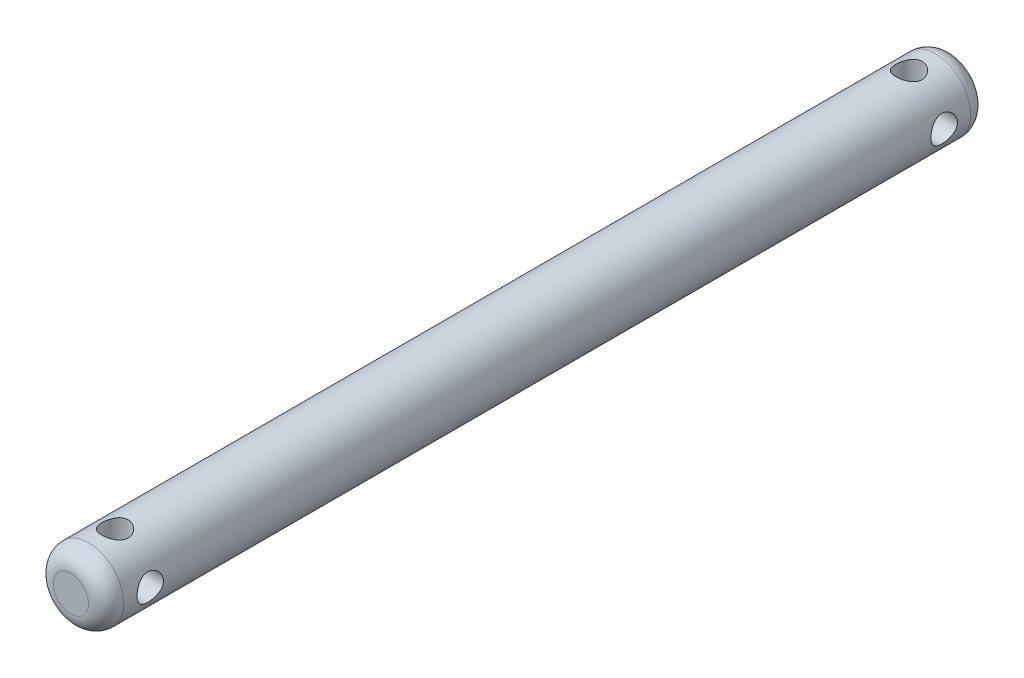
from build123d import *

# Parameters (mm, degrees)
SKETCH1_R           = 4
BOSS_EXTRUDE1_DEPTH = 50
SKETCH2_R           = 1.5
CUT_EXTRUDE1_DEPTH  = 5
FILLET1_R           = 2
SKETCH3_R           = 1.5
CUT_EXTRUDE2_DEPTH  = 4


with BuildPart() as part:
    # Sketch1 → Boss-Extrude1 (new, symmetric)
    with BuildSketch(Plane.XY):
        Circle(SKETCH1_R)
    extrude(amount=BOSS_EXTRUDE1_DEPTH, both=True)

    # Sketch2 → Cut-Extrude1 (cut)
    with BuildSketch(Plane(origin=(0, 0, 0), x_dir=(0, 0, -1), z_dir=(1, 0, 0))):
        with Locations((-45, 0)):
            Circle(SKETCH2_R)
        with Locations((45, 0)):
            Circle(SKETCH2_R)
    extrude(amount=CUT_EXTRUDE1_DEPTH, mode=Mode.SUBTRACT)

    # Fillet1
    fillet1_edges = [part.edges().sort_by_distance(p)[0] for p in [
        (-4, 0, -50),
        (-4, 0, 50),
    ]]
    fillet(fillet1_edges, radius=FILLET1_R)

    # Sketch3 → Cut-Extrude2 (cut)
    with BuildSketch(Plane(origin=(0, 0, 0), x_dir=(1, 0, 0), z_dir=(0, 1, 0))):
        with Locations(Location((0, 45, 0), (0, 0, 90))):
            Circle(SKETCH3_R)
        with Locations(Location((0, -45, 0), (0, 0, 90))):
            Circle(SKETCH3_R)
    extrude(amount=CUT_EXTRUDE2_DEPTH, mode=Mode.SUBTRACT)


solid = part.part
